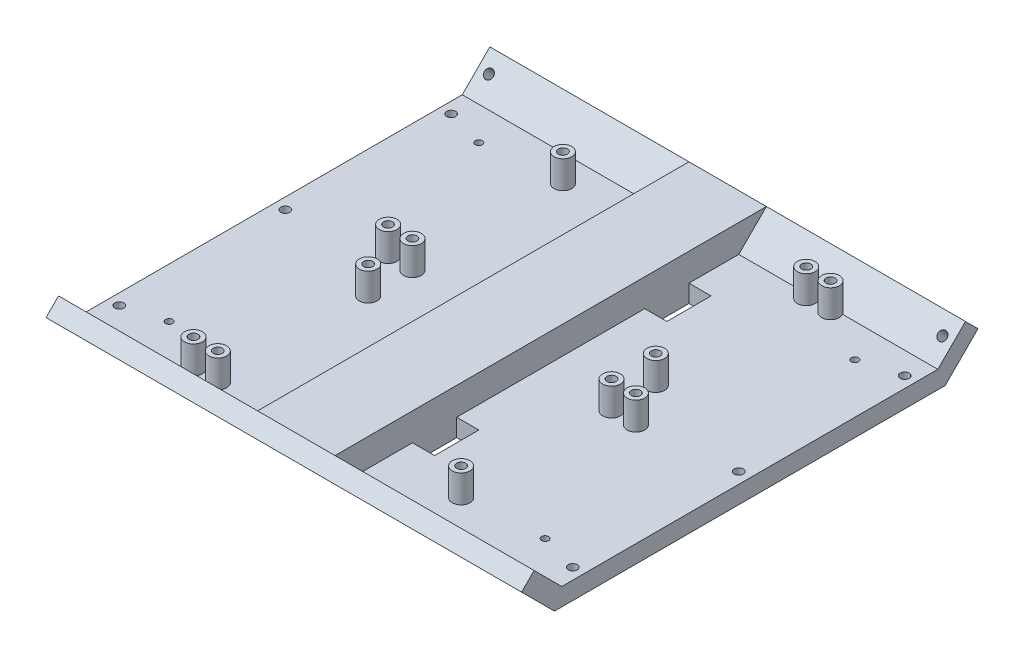
from build123d import *

# Parameters (mm, degrees)
MAIN_DEPTH                                   = 107.5
F_4_0MM_DOWEL_HOLE1_D                        = 4.1
F_4_0MM_DOWEL_HOLE1_ON_FACE_2_D              = 4.1
F_4_0MM_DOWEL_HOLE1_ON_FACE_3_D              = 4.1
F_4_0MM_DOWEL_HOLE1_ON_FACE_4_D              = 4.1
SKETCH4_W                                    = 10
SKETCH4_H                                    = 20
BATTERY_STRAP_CUTOUT_DEPTH                   = 150.511994765
BATTERY_STRAP_CUTOUT_MIRROR_AT_THE_S_2_W     = 10
BATTERY_STRAP_CUTOUT_MIRROR_AT_THE_S_2_H     = 20
BATTERY_STRAP_CUTOUT_MIRROR_AT_THE_S_3_DEPTH = 150.511994765
BATTERY_MOUNT_DEPTH                          = 17.5
PCB_MOUNTS_REACH                             = 152.392
SKETCH7_R                                    = 4
SKETCH8_R                                    = 2.05
PCB_MOUNT_INSERTS_DEPTH                      = 5.7
SKETCH9_R                                    = 1.6
FEET_SCREW_HOLE_DEPTH                        = 151.392275662
MIRROR1_AT_THE_SECOND_PLANE_COPY_1_SKETC_R   = 1.6
MIRROR1_AT_THE_SECOND_PLANE_COPY_1_DEPTH     = 151.392275662


with BuildPart() as part:
    # Sketch2 → Main (new, symmetric)
    with BuildSketch(Plane(origin=(0, 0, 0), x_dir=(0, 0, -1), z_dir=(1, 0, 0))):
        Polygon((-85, 0), (85, 0), (97.5, 12.5), (103.156854249, 6.843145751), (88.313708499, -8), (-88.313708499, -8), (-103.156854249, 6.843145751), (-97.5, 12.5), align=None)
    extrude(amount=MAIN_DEPTH, both=True)

    # Ø4.0mm Dowel Hole1 (through all)
    with Locations(Plane(origin=(-102.5, 7.071067812, -92.071067812), x_dir=(0, 0.707106781187, -0.707106781187), z_dir=(0, 0.707106781187, 0.707106781187))):
        with Locations((0, 0)):
            Hole(F_4_0MM_DOWEL_HOLE1_D / 2)

    # Ø4.0mm Dowel Hole1 on face 2 (through all)
    with Locations(Plane(origin=(-102.5, 0, -75), x_dir=(0, 0, 1), z_dir=(0, 1, 0))):
        with Locations((0, 0), (75, 0), (150, 0), (150, 205), (75, 205), (0, 205)):
            Hole(F_4_0MM_DOWEL_HOLE1_ON_FACE_2_D / 2)

    # Ø4.0mm Dowel Hole1 on face 3 (through all)
    with Locations(Plane(origin=(-102.5, 7.071067812, 92.071067812), x_dir=(0, -0.707106781187, -0.707106781187), z_dir=(0, 0.707106781187, -0.707106781187))):
        with Locations((0, 0), (0, -205)):
            Hole(F_4_0MM_DOWEL_HOLE1_ON_FACE_3_D / 2)

    # Ø4.0mm Dowel Hole1 on face 4 (through all)
    with Locations(Plane(origin=(102.5, 7.071067812, -92.071067812), x_dir=(0, 0.707106781187, -0.707106781187), z_dir=(0, 0.707106781187, 0.707106781187))):
        with Locations((0, 0)):
            Hole(F_4_0MM_DOWEL_HOLE1_ON_FACE_4_D / 2)

    # Sketch4 → Battery strap cutout (cut, through all)
    with BuildSketch(Plane(origin=(0, 0, 0), x_dir=(1, 0, 0), z_dir=(0, 1, 0))):
        with Locations((22.5, 52.5)):
            Rectangle(SKETCH4_W, SKETCH4_H)
    battery_strap_cutout = extrude(amount=-BATTERY_STRAP_CUTOUT_DEPTH, mode=Mode.SUBTRACT)

    # Battery strap cutout mirror: Battery strap cutout across plane
    add(battery_strap_cutout.mirror(Plane(origin=(0, 0, 0), x_dir=(0, 0, 1), z_dir=(1, 0, 0))), mode=Mode.SUBTRACT)

    # Battery strap cutout mirror at the secon: Battery strap cutout across plane
    add(battery_strap_cutout.mirror(Plane.XY), mode=Mode.SUBTRACT)

    # Battery strap cutout mirror at the s 2 → Battery strap cutout mirror at the s 3 (cut, through all)
    with BuildSketch(Plane(origin=(0, 0, 0), x_dir=(-1, 0, 0), z_dir=(0, 1, 0))):
        with Locations((22.5, 52.5)):
            Rectangle(BATTERY_STRAP_CUTOUT_MIRROR_AT_THE_S_2_W, BATTERY_STRAP_CUTOUT_MIRROR_AT_THE_S_2_H)
    extrude(amount=-BATTERY_STRAP_CUTOUT_MIRROR_AT_THE_S_3_DEPTH, mode=Mode.SUBTRACT)

    # Sketch6 → Battery mount (add, symmetric)
    with BuildSketch(Plane(origin=(0, 0, 0), x_dir=(0, 0, -1), z_dir=(1, 0, 0))):
        Polygon((-97.5, 12.5), (97.5, 12.5), (85, 0), (-85, 0), align=None)
    extrude(amount=BATTERY_MOUNT_DEPTH, both=True)

    # PCB mounts: up to this face of the body (flat: up to its plane)
    pcb_mounts_end = Plane(part.part.faces().sort_by_distance((63.47007498, 0, 0))[0])
    # Sketch7 → PCB mounts (add, up to the picked face)
    with BuildSketch(Plane(origin=(0, 12.5, 0), x_dir=(1, 0, 0), z_dir=(0, 1, 0)), mode=Mode.PRIVATE) as pcb_mounts_sk1:
        with Locations(Location((-50, -15, 0), (0, 0, 270))):
            Circle(SKETCH7_R)
    pcb_mounts_tool1 = split(extrude(pcb_mounts_sk1.sketch, amount=-PCB_MOUNTS_REACH, mode=Mode.PRIVATE), bisect_by=pcb_mounts_end, keep=Keep.BOTH, mode=Mode.PRIVATE)
    # Sketch7 → PCB mounts (add, up to the picked face)
    with BuildSketch(Plane(origin=(0, 12.5, 0), x_dir=(1, 0, 0), z_dir=(0, 1, 0)), mode=Mode.PRIVATE) as pcb_mounts_sk2:
        with Locations(Location((-50, -83, 0), (0, 0, 270))):
            Circle(SKETCH7_R)
    pcb_mounts_tool2 = split(extrude(pcb_mounts_sk2.sketch, amount=-PCB_MOUNTS_REACH, mode=Mode.PRIVATE), bisect_by=pcb_mounts_end, keep=Keep.BOTH, mode=Mode.PRIVATE)
    # Sketch7 → PCB mounts (add, up to the picked face)
    with BuildSketch(Plane(origin=(0, 12.5, 0), x_dir=(1, 0, 0), z_dir=(0, 1, 0)), mode=Mode.PRIVATE) as pcb_mounts_sk3:
        with Locations(Location((-61, -83, 0), (0, 0, 270))):
            Circle(SKETCH7_R)
    pcb_mounts_tool3 = split(extrude(pcb_mounts_sk3.sketch, amount=-PCB_MOUNTS_REACH, mode=Mode.PRIVATE), bisect_by=pcb_mounts_end, keep=Keep.BOTH, mode=Mode.PRIVATE)
    # Sketch7 → PCB mounts (add, up to the picked face)
    with BuildSketch(Plane(origin=(0, 12.5, 0), x_dir=(1, 0, 0), z_dir=(0, 1, 0)), mode=Mode.PRIVATE) as pcb_mounts_sk4:
        with Locations(Location((-50, 73, 0), (0, 0, 270))):
            Circle(SKETCH7_R)
    pcb_mounts_tool4 = split(extrude(pcb_mounts_sk4.sketch, amount=-PCB_MOUNTS_REACH, mode=Mode.PRIVATE), bisect_by=pcb_mounts_end, keep=Keep.BOTH, mode=Mode.PRIVATE)
    # Sketch7 → PCB mounts (add, up to the picked face)
    with BuildSketch(Plane(origin=(0, 12.5, 0), x_dir=(1, 0, 0), z_dir=(0, 1, 0)), mode=Mode.PRIVATE) as pcb_mounts_sk5:
        with Locations(Location((-50, 5, 0), (0, 0, 270))):
            Circle(SKETCH7_R)
    pcb_mounts_tool5 = split(extrude(pcb_mounts_sk5.sketch, amount=-PCB_MOUNTS_REACH, mode=Mode.PRIVATE), bisect_by=pcb_mounts_end, keep=Keep.BOTH, mode=Mode.PRIVATE)
    # Sketch7 → PCB mounts (add, up to the picked face)
    with BuildSketch(Plane(origin=(0, 12.5, 0), x_dir=(1, 0, 0), z_dir=(0, 1, 0)), mode=Mode.PRIVATE) as pcb_mounts_sk6:
        with Locations(Location((-61, 5, 0), (0, 0, 270))):
            Circle(SKETCH7_R)
    pcb_mounts_tool6 = split(extrude(pcb_mounts_sk6.sketch, amount=-PCB_MOUNTS_REACH, mode=Mode.PRIVATE), bisect_by=pcb_mounts_end, keep=Keep.BOTH, mode=Mode.PRIVATE)
    # Sketch7 → PCB mounts (add, up to the picked face)
    with BuildSketch(Plane(origin=(0, 12.5, 0), x_dir=(1, 0, 0), z_dir=(0, 1, 0)), mode=Mode.PRIVATE) as pcb_mounts_sk7:
        with Locations(Location((61, 83, 0), (0, 0, 270))):
            Circle(SKETCH7_R)
    pcb_mounts_tool7 = split(extrude(pcb_mounts_sk7.sketch, amount=-PCB_MOUNTS_REACH, mode=Mode.PRIVATE), bisect_by=pcb_mounts_end, keep=Keep.BOTH, mode=Mode.PRIVATE)
    # Sketch7 → PCB mounts (add, up to the picked face)
    with BuildSketch(Plane(origin=(0, 12.5, 0), x_dir=(1, 0, 0), z_dir=(0, 1, 0)), mode=Mode.PRIVATE) as pcb_mounts_sk8:
        with Locations(Location((50, 83, 0), (0, 0, 270))):
            Circle(SKETCH7_R)
    pcb_mounts_tool8 = split(extrude(pcb_mounts_sk8.sketch, amount=-PCB_MOUNTS_REACH, mode=Mode.PRIVATE), bisect_by=pcb_mounts_end, keep=Keep.BOTH, mode=Mode.PRIVATE)
    # Sketch7 → PCB mounts (add, up to the picked face)
    with BuildSketch(Plane(origin=(0, 12.5, 0), x_dir=(1, 0, 0), z_dir=(0, 1, 0)), mode=Mode.PRIVATE) as pcb_mounts_sk9:
        with Locations(Location((50, 15, 0), (0, 0, 270))):
            Circle(SKETCH7_R)
    pcb_mounts_tool9 = split(extrude(pcb_mounts_sk9.sketch, amount=-PCB_MOUNTS_REACH, mode=Mode.PRIVATE), bisect_by=pcb_mounts_end, keep=Keep.BOTH, mode=Mode.PRIVATE)
    # Sketch7 → PCB mounts (add, up to the picked face)
    with BuildSketch(Plane(origin=(0, 12.5, 0), x_dir=(1, 0, 0), z_dir=(0, 1, 0)), mode=Mode.PRIVATE) as pcb_mounts_sk10:
        with Locations(Location((61, -5, 0), (0, 0, 270))):
            Circle(SKETCH7_R)
    pcb_mounts_tool10 = split(extrude(pcb_mounts_sk10.sketch, amount=-PCB_MOUNTS_REACH, mode=Mode.PRIVATE), bisect_by=pcb_mounts_end, keep=Keep.BOTH, mode=Mode.PRIVATE)
    # Sketch7 → PCB mounts (add, up to the picked face)
    with BuildSketch(Plane(origin=(0, 12.5, 0), x_dir=(1, 0, 0), z_dir=(0, 1, 0)), mode=Mode.PRIVATE) as pcb_mounts_sk11:
        with Locations(Location((50, -5, 0), (0, 0, 270))):
            Circle(SKETCH7_R)
    pcb_mounts_tool11 = split(extrude(pcb_mounts_sk11.sketch, amount=-PCB_MOUNTS_REACH, mode=Mode.PRIVATE), bisect_by=pcb_mounts_end, keep=Keep.BOTH, mode=Mode.PRIVATE)
    # Sketch7 → PCB mounts (add, up to the picked face)
    with BuildSketch(Plane(origin=(0, 12.5, 0), x_dir=(1, 0, 0), z_dir=(0, 1, 0)), mode=Mode.PRIVATE) as pcb_mounts_sk12:
        with Locations(Location((50, -73, 0), (0, 0, 270))):
            Circle(SKETCH7_R)
    pcb_mounts_tool12 = split(extrude(pcb_mounts_sk12.sketch, amount=-PCB_MOUNTS_REACH, mode=Mode.PRIVATE), bisect_by=pcb_mounts_end, keep=Keep.BOTH, mode=Mode.PRIVATE)
    add(pcb_mounts_tool1.solids().sort_by(Axis((-50, 12.5, 15), (0, -1, 0)))[0])
    add(pcb_mounts_tool2.solids().sort_by(Axis((-50, 12.5, 83), (0, -1, 0)))[0])
    add(pcb_mounts_tool3.solids().sort_by(Axis((-61, 12.5, 83), (0, -1, 0)))[0])
    add(pcb_mounts_tool4.solids().sort_by(Axis((-50, 12.5, -73), (0, -1, 0)))[0])
    add(pcb_mounts_tool5.solids().sort_by(Axis((-50, 12.5, -5), (0, -1, 0)))[0])
    add(pcb_mounts_tool6.solids().sort_by(Axis((-61, 12.5, -5), (0, -1, 0)))[0])
    add(pcb_mounts_tool7.solids().sort_by(Axis((61, 12.5, -83), (0, -1, 0)))[0])
    add(pcb_mounts_tool8.solids().sort_by(Axis((50, 12.5, -83), (0, -1, 0)))[0])
    add(pcb_mounts_tool9.solids().sort_by(Axis((50, 12.5, -15), (0, -1, 0)))[0])
    add(pcb_mounts_tool10.solids().sort_by(Axis((61, 12.5, 5), (0, -1, 0)))[0])
    add(pcb_mounts_tool11.solids().sort_by(Axis((50, 12.5, 5), (0, -1, 0)))[0])
    add(pcb_mounts_tool12.solids().sort_by(Axis((50, 12.5, 73), (0, -1, 0)))[0])

    # Sketch8 → PCB mount inserts (cut)
    with BuildSketch(Plane(origin=(0, 12.5, 0), x_dir=(1, 0, 0), z_dir=(0, 1, 0))):
        with Locations(Location((-50, 73, 0), (0, 0, 270))):
            Circle(SKETCH8_R)
        with Locations(Location((-50, 5, 0), (0, 0, 270))):
            Circle(SKETCH8_R)
        with Locations(Location((-61, 5, 0), (0, 0, 270))):
            Circle(SKETCH8_R)
        with Locations(Location((-50, -15, 0), (0, 0, 270))):
            Circle(SKETCH8_R)
        with Locations(Location((-61, -83, 0), (0, 0, 270))):
            Circle(SKETCH8_R)
        with Locations(Location((-50, -83, 0), (0, 0, 270))):
            Circle(SKETCH8_R)
        with Locations(Location((50, -73, 0), (0, 0, 270))):
            Circle(SKETCH8_R)
        with Locations(Location((61, -5, 0), (0, 0, 270))):
            Circle(SKETCH8_R)
        with Locations(Location((50, -5, 0), (0, 0, 270))):
            Circle(SKETCH8_R)
        with Locations(Location((50, 15, 0), (0, 0, 270))):
            Circle(SKETCH8_R)
        with Locations(Location((61, 83, 0), (0, 0, 270))):
            Circle(SKETCH8_R)
        with Locations(Location((50, 83, 0), (0, 0, 270))):
            Circle(SKETCH8_R)
    extrude(amount=-PCB_MOUNT_INSERTS_DEPTH, mode=Mode.SUBTRACT)

    # Sketch9 → Feet screw hole (cut, through all)
    with BuildSketch(Plane.XZ.offset(8)):
        with Locations(Location((85, 70, 0), (0, 0, 270))):
            Circle(SKETCH9_R)
    feet_screw_hole = extrude(amount=-FEET_SCREW_HOLE_DEPTH, mode=Mode.SUBTRACT)

    # Mirror1: Feet screw hole across plane
    add(feet_screw_hole.mirror(Plane.XY), mode=Mode.SUBTRACT)

    # Mirror1 at the second plane: Feet screw hole across plane
    add(feet_screw_hole.mirror(Plane(origin=(0, 0, 0), x_dir=(0, 0, 1), z_dir=(1, 0, 0))), mode=Mode.SUBTRACT)

    # Mirror1 at the second plane copy 1 sketc → Mirror1 at the second plane copy 1 (cut, through all)
    with BuildSketch(Plane(origin=(0, -8, 0), x_dir=(-1, 0, 0), z_dir=(0, -1, 0))):
        with Locations(Location((85, 70, 0), (0, 0, 270))):
            Circle(MIRROR1_AT_THE_SECOND_PLANE_COPY_1_SKETC_R)
    extrude(amount=-MIRROR1_AT_THE_SECOND_PLANE_COPY_1_DEPTH, mode=Mode.SUBTRACT)


solid = part.part
